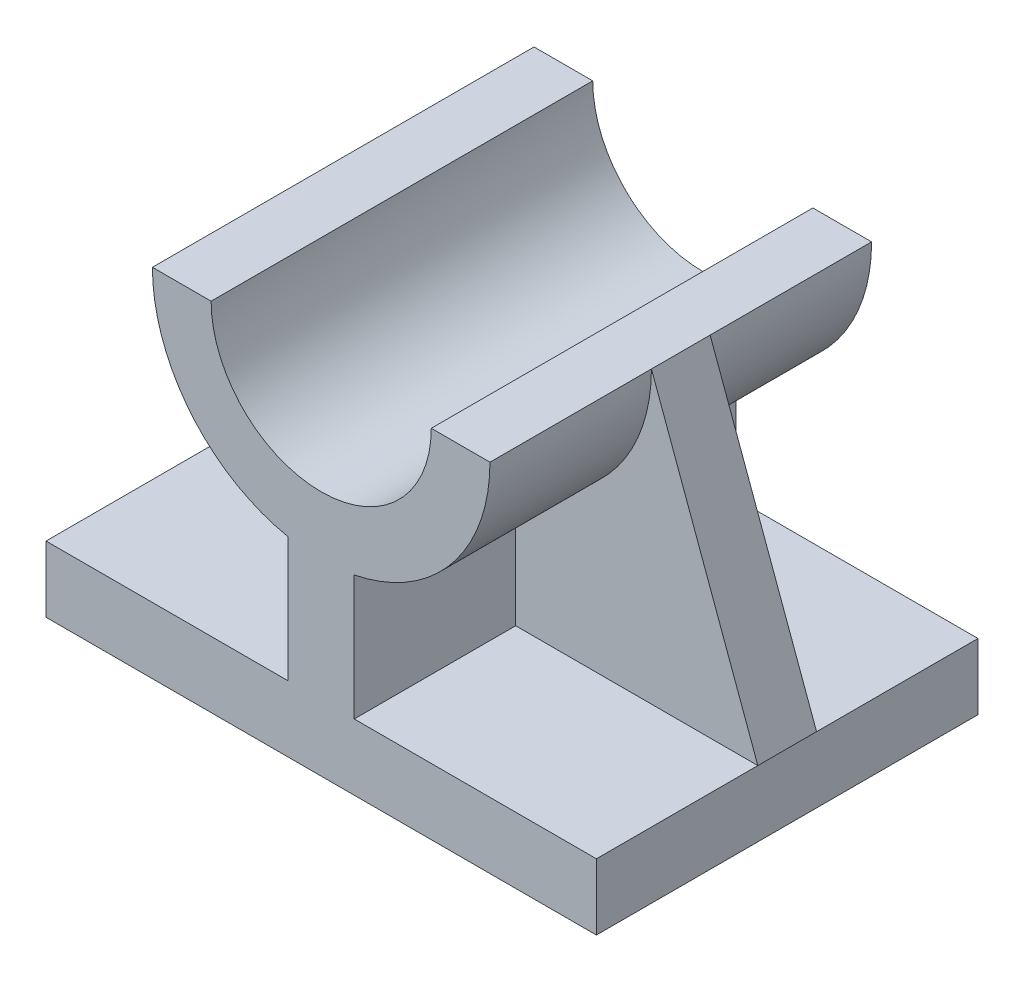
from build123d import *

# Parameters (mm, degrees)
SKETCH1_W                = 75
SKETCH1_H                = 52
BOSS_EXTRUDE1_DEPTH      = 9
BOSS_EXTRUDE2_DEPTH      = 52
BOSS_EXTRUDE3_DEPTH      = 4
BOSS_EXTRUDE3_DEPTH_BACK = 4


with BuildPart() as part:
    # Sketch1 → Boss-Extrude1 (new body)
    with BuildSketch(Plane(origin=(0, 0, 0), x_dir=(1, 0, 0), z_dir=(0, 1, 0))):
        Rectangle(SKETCH1_W, SKETCH1_H)
    extrude(amount=BOSS_EXTRUDE1_DEPTH)

    # Sketch2 → Boss-Extrude2 (add)
    with BuildSketch(Plane.XY.offset(26)):
        with BuildLine():
            Line((-4.5, 26), (-4.5, 9))
            Line((-4.5, 9), (4.5, 9))
            Line((4.5, 9), (4.5, 26))
            ThreePointArc((4.5, 26), (17.783419244, 33.969534991), (23, 48.555487137))
            Line((23, 48.555487137), (15, 48.555487137))
            ThreePointArc((15, 48.555487137), (0, 33.555487137), (-15, 48.555487137))
            Line((-15, 48.555487137), (-23, 48.555487137))
            ThreePointArc((-23, 48.555487137), (-17.783419244, 33.969534991), (-4.5, 26))
        make_face()
    extrude(amount=-BOSS_EXTRUDE2_DEPTH)

    # Sketch3 → Boss-Extrude3 (add, two sides: drawn at the far end of the back side and taken through both)
    with BuildSketch(Plane.XY.offset(-BOSS_EXTRUDE3_DEPTH_BACK)):
        with BuildLine():
            Line((4.5, 9), (37.5, 9))
            Line((37.5, 9), (23, 48.555487137))
            ThreePointArc((23, 48.555487137), (17.783419244, 33.969534991), (4.5, 26))
            Line((4.5, 26), (4.5, 9))
        make_face()
    extrude(amount=BOSS_EXTRUDE3_DEPTH + BOSS_EXTRUDE3_DEPTH_BACK)


solid = part.part
